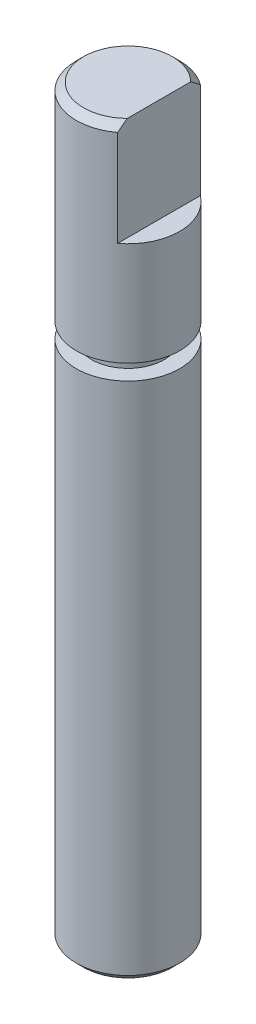
from build123d import *

# Parameters (mm, degrees)
ENL_V_MAT_EXTRU_1_DEPTH      = 73.346388991
ENL_V_MAT_EXTRU_1_DEPTH_BACK = 73.346388991
ESQUISSE2_W                  = 6
ESQUISSE2_H                  = 14


with BuildPart() as part:
    # Esquisse1 → Révolution1 (revolve)
    with BuildSketch(Plane.XY):
        Polygon((0, 0), (-4.292893219, 0), (-5, 0.707106781), (-5, 50.5), (-3.5, 50.5), (-3.5, 52), (-5, 52), (-5, 71.292893219), (-4.292893219, 72), (0, 72), align=None)
    revolve(axis=Axis((0, 72, 0), (0, -1, 0)))

    # Esquisse2 → Enlèv. mat.-Extru.1 (cut, two sides: drawn at the far end of the back side and taken through both)
    with BuildSketch(Plane.XY.offset(-ENL_V_MAT_EXTRU_1_DEPTH_BACK)):
        with Locations((6, 69)):
            Rectangle(ESQUISSE2_W, ESQUISSE2_H)
    extrude(amount=ENL_V_MAT_EXTRU_1_DEPTH + ENL_V_MAT_EXTRU_1_DEPTH_BACK, mode=Mode.SUBTRACT)


solid = part.part
